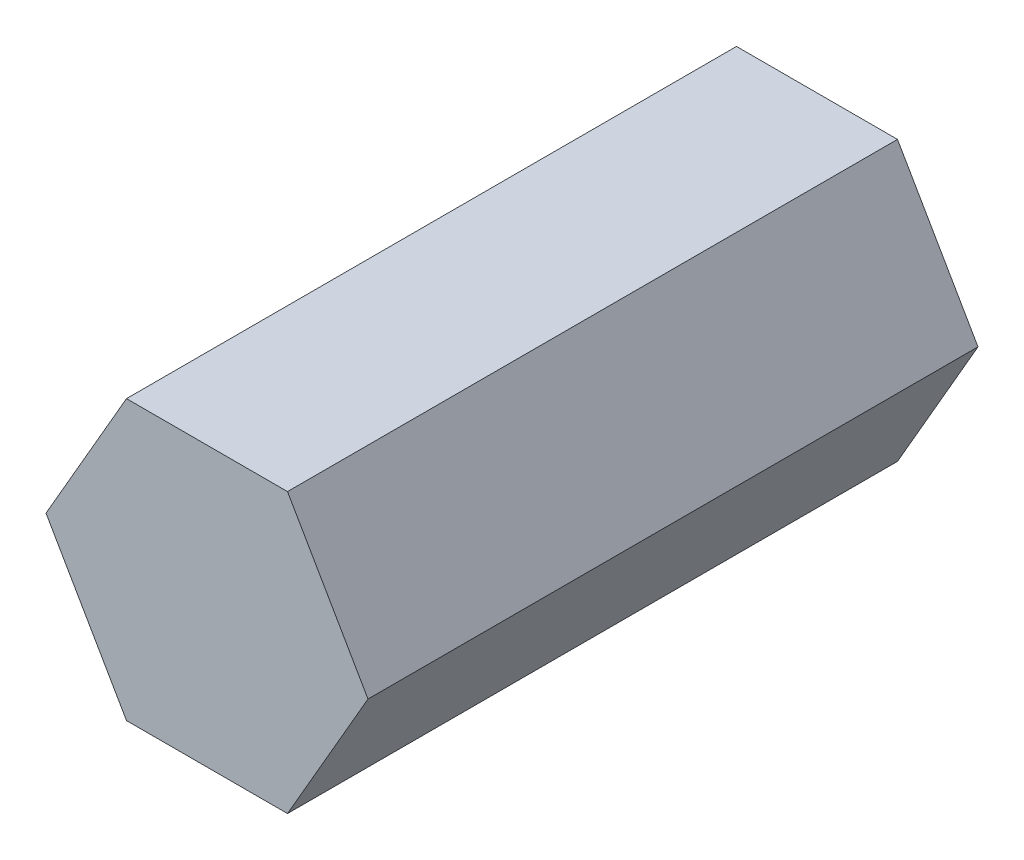
from build123d import *

# Parameters (mm, degrees)
EXTRUDE_1_DEPTH        = 7
HOLE_WIZARD_M2_1_D     = 1.6
HOLE_WIZARD_M2_1_DEPTH = 6
HOLE_WIZARD_M2_1_TIP   = 0.480688495


with BuildPart() as part:
    # 草图1 → 拉伸1 (new body)
    with BuildSketch(Plane.XY):
        Polygon((0.923760431, -1.6), (1.847520861, 0), (0.923760431, 1.6), (-0.923760431, 1.6), (-1.847520861, 0), (-0.923760431, -1.6), align=None)
    extrude(amount=EXTRUDE_1_DEPTH)

    # M2 螺纹孔1
    with Locations(Plane(origin=(0, 0, 0), x_dir=(-1, 0, 0), z_dir=(0, 0, -1))):
        with Locations((0, 0)):
            Hole(HOLE_WIZARD_M2_1_D / 2, depth=HOLE_WIZARD_M2_1_DEPTH)
            with Locations((0, 0, -(HOLE_WIZARD_M2_1_DEPTH + HOLE_WIZARD_M2_1_TIP / 2))):  # 118° drill point
                Cone(0, HOLE_WIZARD_M2_1_D / 2, HOLE_WIZARD_M2_1_TIP, mode=Mode.SUBTRACT)


solid = part.part
